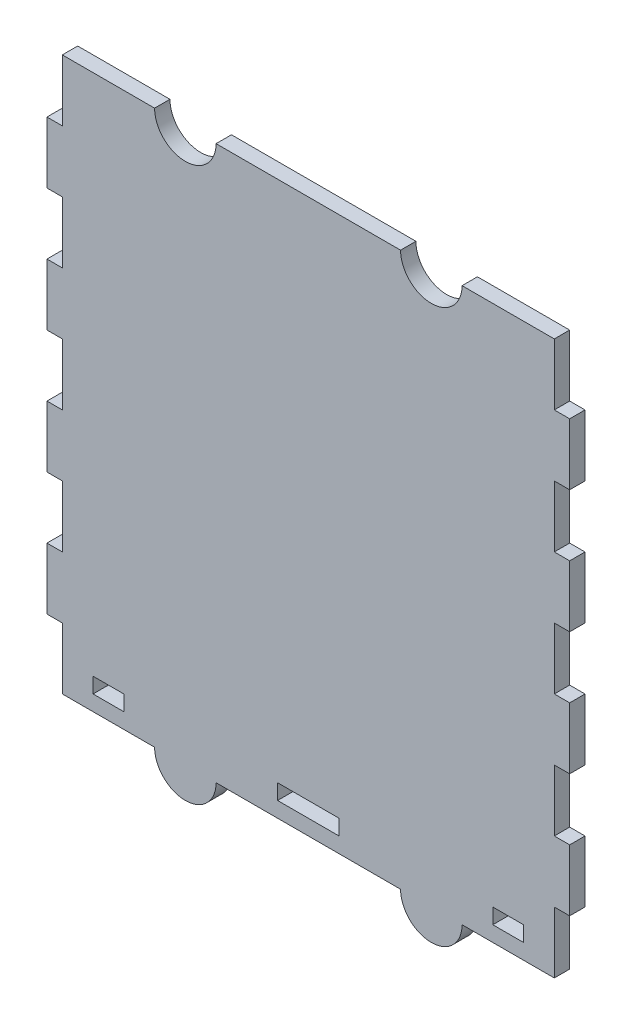
from build123d import *

# Parameters (mm, degrees)
SKETCH1_W           = 10
SKETCH1_H           = 2.5
SKETCH1_W_2         = 5
BOSS_EXTRUDE1_DEPTH = 2.5


with BuildPart() as part:
    # Sketch1 → Boss-Extrude1 (new body)
    with BuildSketch(Plane.XY):
        with BuildLine():
            Line((42.5, 60), (42.5, 50))
            Line((42.5, 50), (40, 50))
            Line((40, 50), (40, 40))
            Line((40, 40), (42.5, 40))
            Line((42.5, 40), (42.5, 30))
            Line((42.5, 30), (40, 30))
            Line((40, 30), (40, 20))
            Line((40, 20), (42.5, 20))
            Line((42.5, 20), (42.5, 10))
            Line((42.5, 10), (40, 10))
            Line((40, 10), (40, 0))
            Line((40, 0), (25, 0))
            ThreePointArc((25, 0), (20, -5), (15, 0))
            Line((15, 0), (-15, 0))
            ThreePointArc((-15, 0), (-20, -5), (-25, 0))
            Line((-25, 0), (-40, 0))
            Line((-40, 0), (-40, 10))
            Line((-40, 10), (-42.5, 10))
            Line((-42.5, 10), (-42.5, 20))
            Line((-42.5, 20), (-40, 20))
            Line((-40, 20), (-40, 30))
            Line((-40, 30), (-42.5, 30))
            Line((-42.5, 30), (-42.5, 40))
            Line((-42.5, 40), (-40, 40))
            Line((-40, 40), (-40, 50))
            Line((-40, 50), (-42.5, 50))
            Line((-42.5, 50), (-42.5, 60))
            Line((-42.5, 60), (-40, 60))
            Line((-40, 60), (-40, 70))
            Line((-40, 70), (-42.5, 70))
            Line((-42.5, 70), (-42.5, 80))
            Line((-42.5, 80), (-40, 80))
            Line((-40, 80), (-40, 90))
            Line((-40, 90), (-25, 90))
            ThreePointArc((-25, 90), (-20, 85), (-15, 90))
            Line((-15, 90), (15, 90))
            ThreePointArc((15, 90), (20, 85), (25, 90))
            Line((25, 90), (40, 90))
            Line((40, 90), (40, 80))
            Line((40, 80), (42.5, 80))
            Line((42.5, 80), (42.5, 70))
            Line((42.5, 70), (40, 70))
            Line((40, 70), (40, 60))
            Line((40, 60), (42.5, 60))
        make_face()
        with Locations((0, 3.75)):
            Rectangle(SKETCH1_W, SKETCH1_H, mode=Mode.SUBTRACT)
        with Locations((32.5, 3.75)):
            Rectangle(SKETCH1_W_2, SKETCH1_H, mode=Mode.SUBTRACT)
        with Locations((-32.5, 3.75)):
            Rectangle(SKETCH1_W_2, SKETCH1_H, mode=Mode.SUBTRACT)
    extrude(amount=BOSS_EXTRUDE1_DEPTH)


solid = part.part
